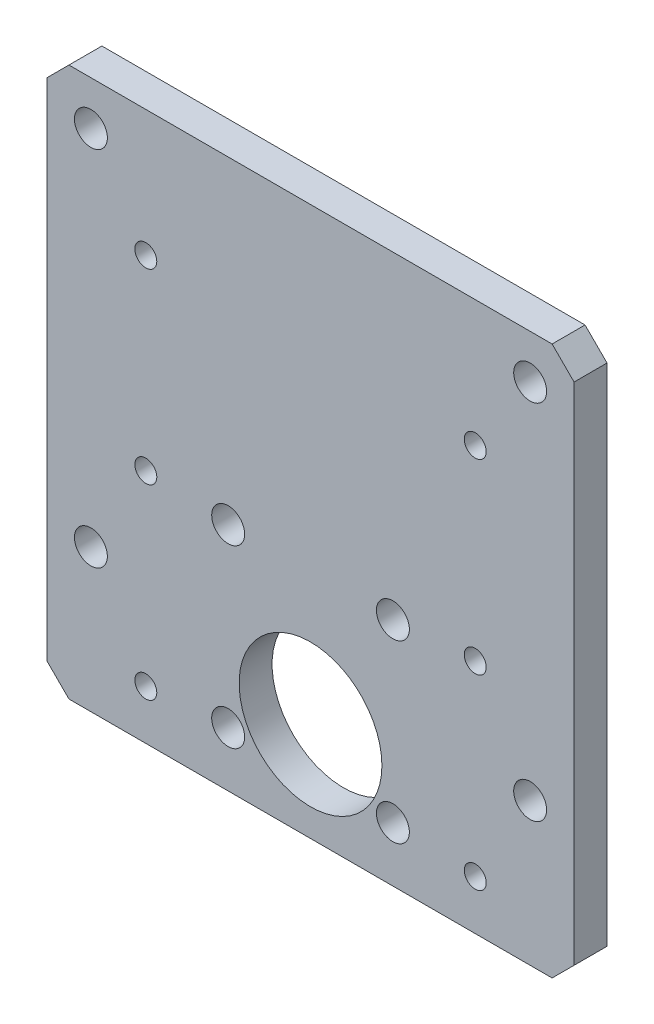
from build123d import *

# Parameters (mm, degrees)
ESBO_O1_W                = 48
ESBO_O1_H                = 26
ESBO_O1_R                = 1.5
ESBO_O1_R_2              = 1
ESBO_O1_R_3              = 6.5
RESSALTO_EXTRUS_O1_DEPTH = 3
ESBO_O7_W                = 48
ESBO_O7_H                = 3
RESSALTO_EXTRUS_O4_DEPTH = 24
ESBO_O8_R                = 1
ESBO_O8_R_2              = 1.5
CORTE_EXTRUS_O2_DEPTH    = 3
CHANFRO2_SIZE            = 2


with BuildPart() as part:
    # Esboço1 → Ressalto-extrusão1 (new body)
    with BuildSketch(Plane.XY):
        Rectangle(ESBO_O1_W, ESBO_O1_H)
        with Locations((20, 0)):
            Circle(ESBO_O1_R, mode=Mode.SUBTRACT)
        with Locations((15, 8.5)):
            Circle(ESBO_O1_R_2, mode=Mode.SUBTRACT)
        with Locations((7.5, 8)):
            Circle(ESBO_O1_R, mode=Mode.SUBTRACT)
        with Locations(Location((15, -8.5, 0), (0, 0, 180))):
            Circle(ESBO_O1_R_2, mode=Mode.SUBTRACT)
        with Locations(Location((7.5, -8, 0), (0, 0, 180))):
            Circle(ESBO_O1_R, mode=Mode.SUBTRACT)
        with Locations(Location((-15, 8.5, 0), (0, 0, 180))):
            Circle(ESBO_O1_R_2, mode=Mode.SUBTRACT)
        with Locations((-7.5, -8)):
            Circle(ESBO_O1_R, mode=Mode.SUBTRACT)
        with Locations((-15, -8.5)):
            Circle(ESBO_O1_R_2, mode=Mode.SUBTRACT)
        with Locations(Location((-7.5, 8, 0), (0, 0, 180))):
            Circle(ESBO_O1_R, mode=Mode.SUBTRACT)
        with Locations(Location((-20, 0, 0), (0, 0, 180))):
            Circle(ESBO_O1_R, mode=Mode.SUBTRACT)
        with Locations((0, -4)):
            Circle(ESBO_O1_R_3, mode=Mode.SUBTRACT)
    extrude(amount=RESSALTO_EXTRUS_O1_DEPTH)

    # Esboço7 → Ressalto-extrusão4 (add)
    with BuildSketch(Plane(origin=(0, 13, 0), x_dir=(1, 0, 0), z_dir=(0, 1, 0))):
        with Locations((0, -1.5)):
            Rectangle(ESBO_O7_W, ESBO_O7_H)
    extrude(amount=RESSALTO_EXTRUS_O4_DEPTH)

    # Esboço8 → Corte-extrusão2 (cut)
    with BuildSketch(Plane.XY.offset(3)):
        with Locations((-15, 25.5)):
            Circle(ESBO_O8_R)
        with Locations((-20, 33)):
            Circle(ESBO_O8_R_2)
        with Locations((20, 33)):
            Circle(ESBO_O8_R_2)
        with Locations((15, 25.5)):
            Circle(ESBO_O8_R)
    extrude(amount=-CORTE_EXTRUS_O2_DEPTH, mode=Mode.SUBTRACT)

    # Chanfro2
    chanfro2_edges = [part.edges().sort_by_distance(p)[0] for p in [
        (-24, 37, 1.5),
        (24, 37, 1.5),
        (24, -13, 1.5),
        (-24, -13, 1.5),
    ]]
    chamfer(chanfro2_edges, length=CHANFRO2_SIZE)


solid = part.part
